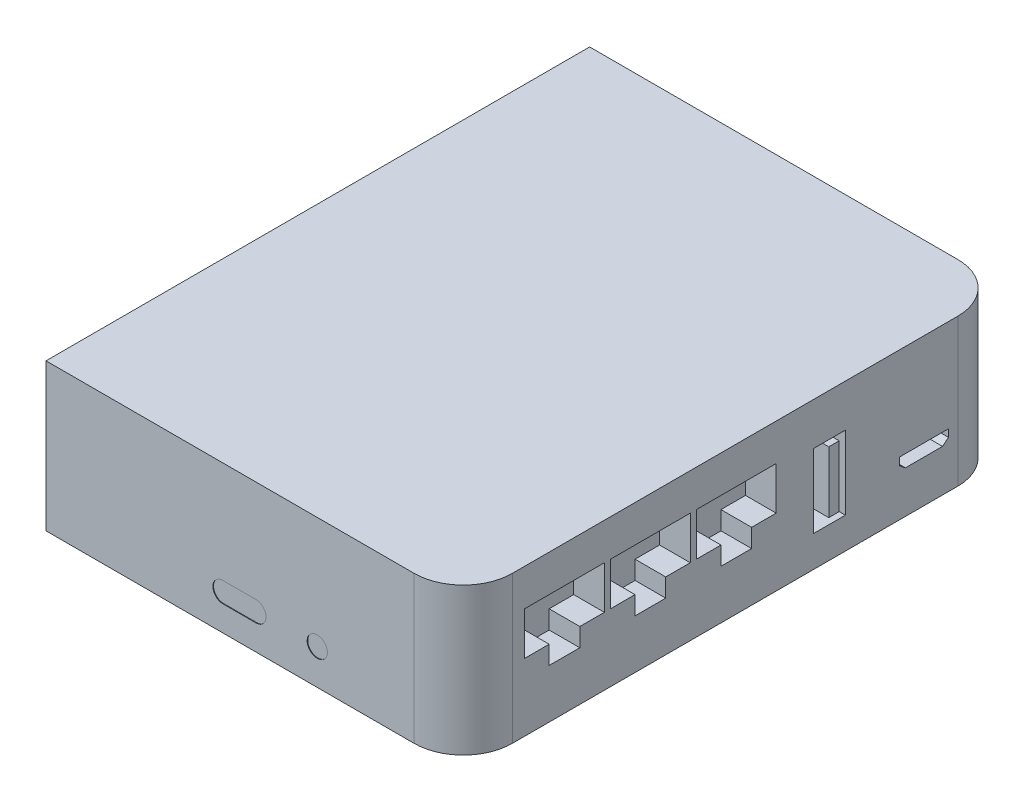
from build123d import *

# Parameters (mm, degrees)
ESQUISSE1_W             = 68
ESQUISSE1_H             = 88.6
BOSS_EXTRU_1_DEPTH      = 24
ESQUISSE2_W             = 5.2
ESQUISSE2_H             = 12
ESQUISSE2_W_2           = 1.7
ESQUISSE2_H_2           = 10
ENL_V_MAT_EXTRU_1_DEPTH = 5
ESQUISSE3_W             = 13.5
ESQUISSE3_H             = 1.8
ENL_V_MAT_EXTRU_2_DEPTH = 5
ESQUISSE4_R             = 1.65
ENL_V_MAT_EXTRU_3_DEPTH = 0.1
ESQUISSE5_R             = 2.5
BOSS_EXTRU_3_DEPTH      = 1.8
CONG_1_R                = 8


with BuildPart() as part:
    # Esquisse1 → Boss.-Extru.1 (new body)
    with BuildSketch(Plane(origin=(0, 0, 0), x_dir=(1, 0, 0), z_dir=(0, 1, 0))):
        Rectangle(ESQUISSE1_W, ESQUISSE1_H)
    extrude(amount=BOSS_EXTRU_1_DEPTH)

    # Esquisse2 → Enlèv. mat.-Extru.1 (cut)
    # profile 1 of 5: a face of its own
    with BuildSketch(Plane(origin=(34, 0, 0), x_dir=(0, 0, -1), z_dir=(1, 0, 0))):
        Polygon((-34.3, 18), (-34.3, 11), (-30.3, 11), (-30.3, 8), (-25.3, 8), (-25.3, 11), (-21.3, 11), (-21.3, 18), align=None)
    # profile 2 of 5: a face of its own
    with BuildSketch(Plane(origin=(34, 0, 0), x_dir=(0, 0, -1), z_dir=(1, 0, 0))):
        Polygon((-7.3, 18), (-20.3, 18), (-20.3, 11), (-16.3, 11), (-16.3, 8), (-11.3, 8), (-11.3, 11), (-7.3, 11), align=None)
    # profile 3 of 5: a face of its own
    with BuildSketch(Plane(origin=(34, 0, 0), x_dir=(0, 0, -1), z_dir=(1, 0, 0))):
        Polygon((6.7, 18), (-6.3, 18), (-6.3, 11), (-2.3, 11), (-2.3, 8), (2.7, 8), (2.7, 11), (6.7, 11), align=None)
    # profile 4 of 5: a face of its own
    with BuildSketch(Plane(origin=(34, 0, 0), x_dir=(0, 0, -1), z_dir=(1, 0, 0))):
        Polygon((26.784034195, 8.864890508), (34.784034195, 8.864890508), (34.784034195, 7.653311673), (33.810896432, 6.864890508), (27.757171958, 6.864890508), (26.784034195, 7.653311673), align=None)
    # profile 5 of 5: a face of its own
    with BuildSketch(Plane(origin=(34, 0, 0), x_dir=(0, 0, -1), z_dir=(1, 0, 0))):
        with Locations((15.369525707, 11.07791291)):
            Rectangle(ESQUISSE2_W, ESQUISSE2_H)
        with Locations((16.119525707, 11.07791291)):
            Rectangle(ESQUISSE2_W_2, ESQUISSE2_H_2, mode=Mode.SUBTRACT)
    extrude(amount=-ENL_V_MAT_EXTRU_1_DEPTH, mode=Mode.SUBTRACT)

    # Esquisse3 → Enlèv. mat.-Extru.2 (cut)
    with BuildSketch(Plane(origin=(0, 0, -44.3), x_dir=(-1, 0, 0), z_dir=(0, 0, -1))):
        with Locations((4.25, 5.9)):
            Rectangle(ESQUISSE3_W, ESQUISSE3_H)
    extrude(amount=-ENL_V_MAT_EXTRU_2_DEPTH, mode=Mode.SUBTRACT)

    # Esquisse4 → Enlèv. mat.-Extru.3 (cut)
    with BuildSketch(Plane.XY.offset(44.3)):
        with Locations((10.211694525, 5.763285302)):
            Circle(ESQUISSE4_R)
        with BuildLine():
            Line((-5.15123343, 7.413285302), (0.211694525, 7.413285302))
            ThreePointArc((0.211694525, 7.413285302), (1.861694525, 5.763285302), (0.211694525, 4.113285302))
            Line((0.211694525, 4.113285302), (-5.15123343, 4.113285302))
            ThreePointArc((-5.15123343, 4.113285302), (-6.80123343, 5.763285302), (-5.15123343, 7.413285302))
        make_face()
    extrude(amount=-ENL_V_MAT_EXTRU_3_DEPTH, mode=Mode.SUBTRACT)

    # Esquisse5 → Boss.-Extru.3 (add)
    with BuildSketch(Plane.XZ):
        with Locations(Location((-18.5, 37, 0), (0, 0, 90))):
            Circle(ESQUISSE5_R)
        with Locations(Location((18.5, 37, 0), (0, 0, 90))):
            Circle(ESQUISSE5_R)
        with Locations(Location((18.5, -37, 0), (0, 0, 90))):
            Circle(ESQUISSE5_R)
        with Locations(Location((-18.5, -37, 0), (0, 0, 90))):
            Circle(ESQUISSE5_R)
    extrude(amount=BOSS_EXTRU_3_DEPTH)

    # Congé1
    cong_1_edges = [part.edges().sort_by_distance(p)[0] for p in [
        (34, 12, -44.3),
        (34, 12, 44.3),
    ]]
    fillet(cong_1_edges, radius=CONG_1_R)


solid = part.part
